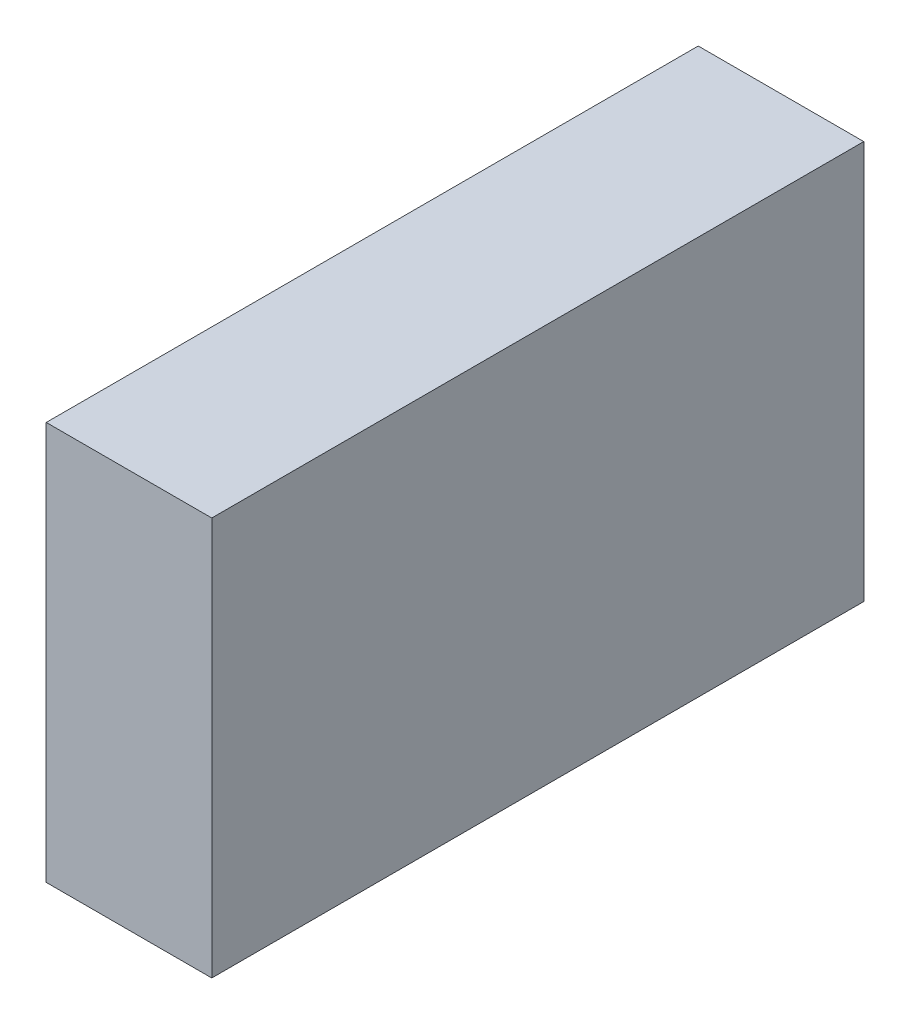
from build123d import *

# Parameters (mm, degrees)
SKETCH1_W           = 24.88
SKETCH1_H           = 59.88
BOSS_EXTRUDE1_DEPTH = 98


with BuildPart() as part:
    # Sketch1 → Boss-Extrude1 (new body)
    with BuildSketch(Plane.XY):
        with Locations((58, 0)):
            Rectangle(SKETCH1_W, SKETCH1_H)
    extrude(amount=-BOSS_EXTRUDE1_DEPTH)


solid = part.part
